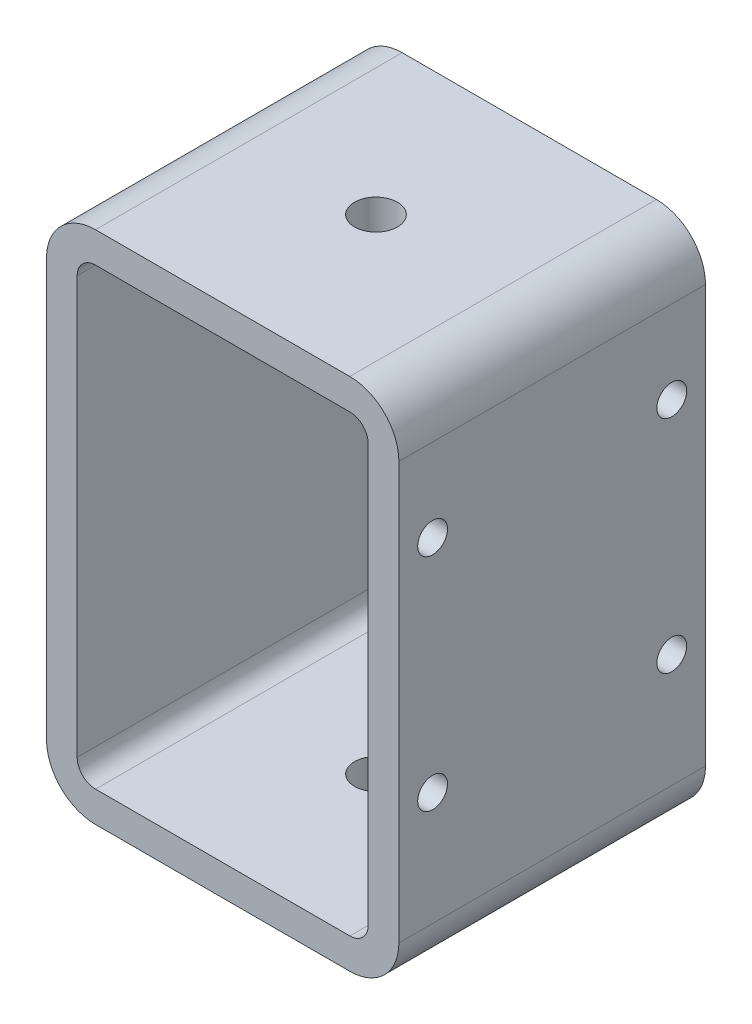
from build123d import *

# Parameters (mm, degrees)
BOSS_EXTRUDE1_DEPTH  = 25
SHELL1_T             = -2.5
SKETCH2_R            = 1.75
CUT_EXTRUDE1_DEPTH   = 57.695792613
SKETCH3_R            = 1.215
CUT_EXTRUDE2_DEPTH   = 2.5
LPATTERN1_COUNT      = 2
LPATTERN1_PITCH      = 18
LPATTERN1_COUNT_DIR2 = 2
LPATTERN1_PITCH_DIR2 = 19.5


with BuildPart() as part:
    # Sketch1 → Boss-Extrude1 (new body)
    with BuildSketch(Plane.XY):
        with BuildLine():
            Line((0, 4), (0, 38))
            ThreePointArc((0, 38), (1.171572875, 40.828427125), (4, 42))
            Line((4, 42), (24.73, 42))
            ThreePointArc((24.73, 42), (27.558427125, 40.828427125), (28.73, 38))
            Line((28.73, 38), (28.73, 4))
            ThreePointArc((28.73, 4), (27.558427125, 1.171572875), (24.73, 0))
            Line((24.73, 0), (4, 0))
            ThreePointArc((4, 0), (1.171572875, 1.171572875), (0, 4))
        make_face()
    extrude(amount=BOSS_EXTRUDE1_DEPTH)

    # Shell1
    shell1_openings = [part.faces().sort_by_distance(p)[0] for p in [
        (14.365, 21, 25),
        (14.365, 21, 0),
    ]]
    offset(amount=SHELL1_T, openings=shell1_openings, kind=Kind.INTERSECTION)

    # Sketch2 → Cut-Extrude1 (cut, through all)
    with BuildSketch(Plane(origin=(0, 42, 0), x_dir=(1, 0, 0), z_dir=(0, 1, 0))):
        with Locations(Location((14.365, -12.5, 0), (0, 0, 270))):
            Circle(SKETCH2_R)
    extrude(amount=-CUT_EXTRUDE1_DEPTH, mode=Mode.SUBTRACT)

    # Sketch3 → Cut-Extrude2 (cut)
    with BuildSketch(Plane(origin=(28.73, 0, 0), x_dir=(0, 0, -1), z_dir=(1, 0, 0))):
        with Locations(Location((-22.25, 31.25, 0), (0, 0, 90))):
            Circle(SKETCH3_R)
    cut_extrude2 = extrude(amount=-CUT_EXTRUDE2_DEPTH, mode=Mode.SUBTRACT)

    # LPattern1: Cut-Extrude2 2 × 2
    with Locations(*[(0, -i * LPATTERN1_PITCH, -j * LPATTERN1_PITCH_DIR2) for i in range(LPATTERN1_COUNT) for j in range(LPATTERN1_COUNT_DIR2) if (i, j) != (0, 0)]):
        add(cut_extrude2, mode=Mode.SUBTRACT)


solid = part.part
